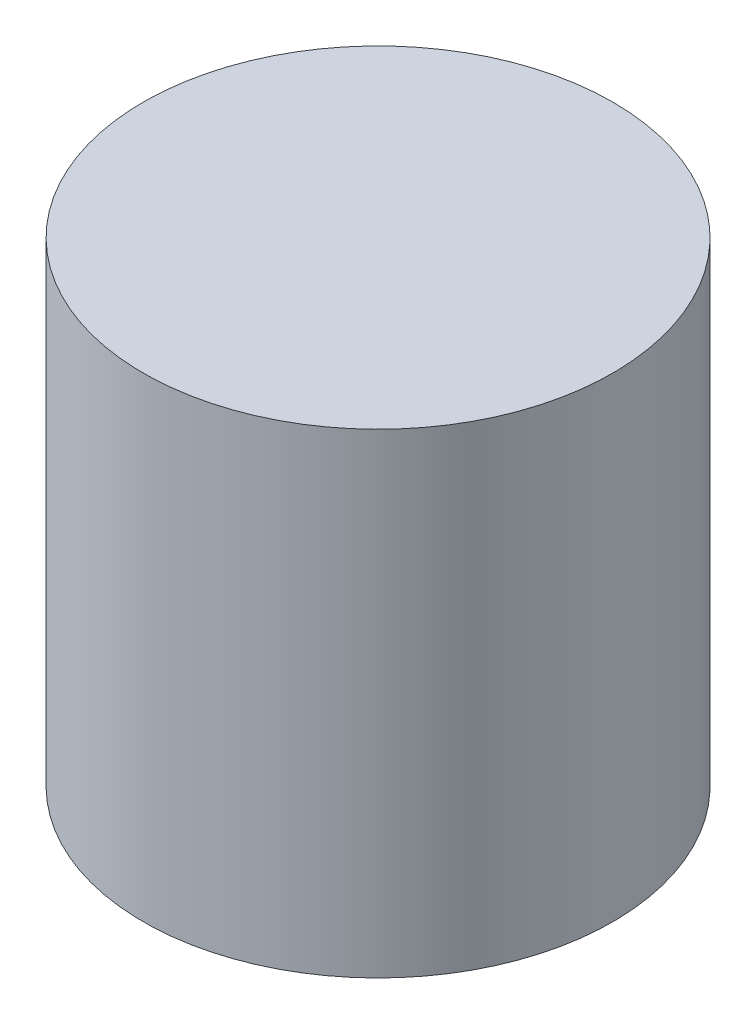
from build123d import *

# Parameters (mm, degrees)
SKETCH1_R           = 3.1242
BOSS_EXTRUDE1_DEPTH = 6.3246


with BuildPart() as part:
    # Sketch1 → Boss-Extrude1 (new body)
    with BuildSketch(Plane(origin=(0, 0, 0), x_dir=(1, 0, 0), z_dir=(0, 1, 0))):
        with Locations(Location((0, 0, 0), (0, 0, 90))):
            Circle(SKETCH1_R)
    extrude(amount=BOSS_EXTRUDE1_DEPTH)


solid = part.part
